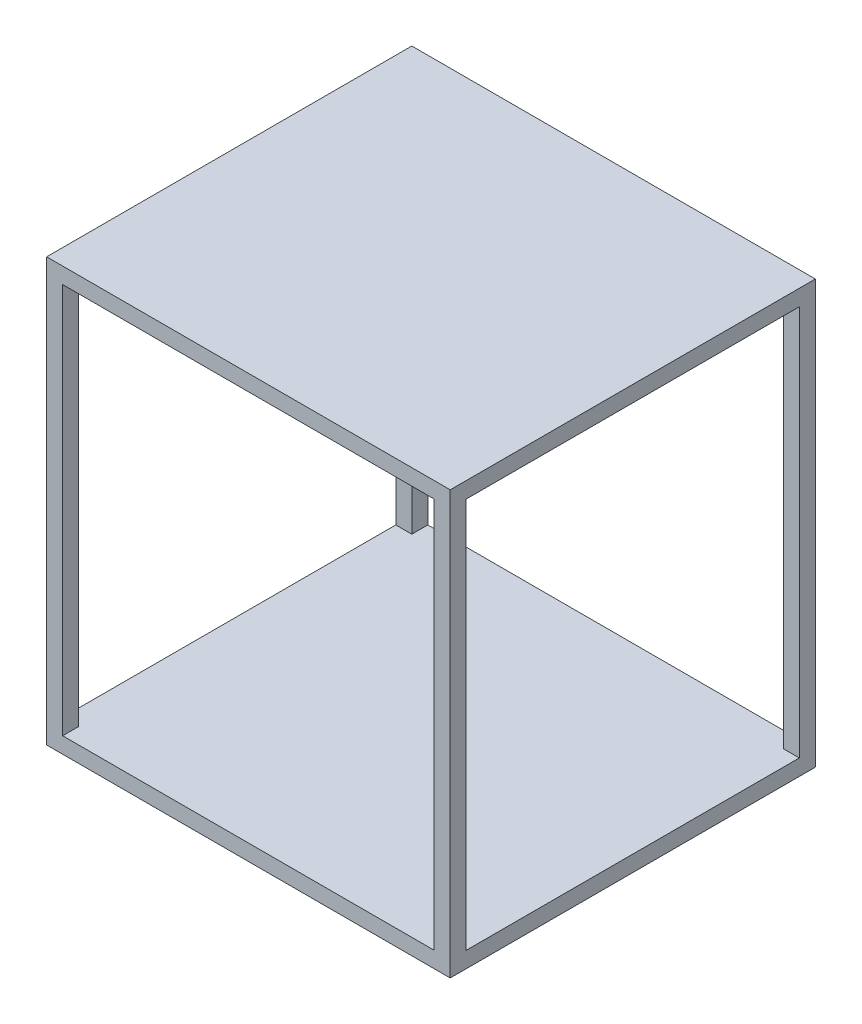
from build123d import *

# Parameters (mm, degrees)
SKETCH2_W               = 630
SKETCH2_H               = 570
BOSS_EXTRUDE1_DEPTH     = 660
CUT_EXTRUDE1_DEPTH      = 928.213567632
CUT_EXTRUDE1_DEPTH_BACK = 928.213567632
SKETCH4_W               = 580
SKETCH4_H               = 610
CUT_EXTRUDE2_DEPTH      = 956.889637981
CUT_EXTRUDE2_DEPTH_BACK = 956.889637981
SKETCH5_W               = 520
SKETCH5_H               = 610


with BuildPart() as part:
    # Sketch2 → Boss-Extrude1 (new body)
    with BuildSketch(Plane(origin=(0, 0, 0), x_dir=(1, 0, 0), z_dir=(0, 1, 0))):
        Rectangle(SKETCH2_W, SKETCH2_H)
    extrude(amount=BOSS_EXTRUDE1_DEPTH)

    # Sketch4 → Cut-Extrude1 (cut, two sides: drawn at the far end of the back side and taken through both)
    with BuildSketch(Plane.XY.offset(285).offset(-CUT_EXTRUDE1_DEPTH_BACK)):
        with Locations((0, 330)):
            Rectangle(SKETCH4_W, SKETCH4_H)
    extrude(amount=CUT_EXTRUDE1_DEPTH + CUT_EXTRUDE1_DEPTH_BACK, mode=Mode.SUBTRACT)

    # Sketch5 → Cut-Extrude2 (cut, two sides: drawn at the far end of the back side and taken through both)
    with BuildSketch(Plane.ZY.offset(315).offset(-CUT_EXTRUDE2_DEPTH_BACK)):
        with Locations((0, 330)):
            Rectangle(SKETCH5_W, SKETCH5_H)
    extrude(amount=CUT_EXTRUDE2_DEPTH + CUT_EXTRUDE2_DEPTH_BACK, mode=Mode.SUBTRACT)


solid = part.part
